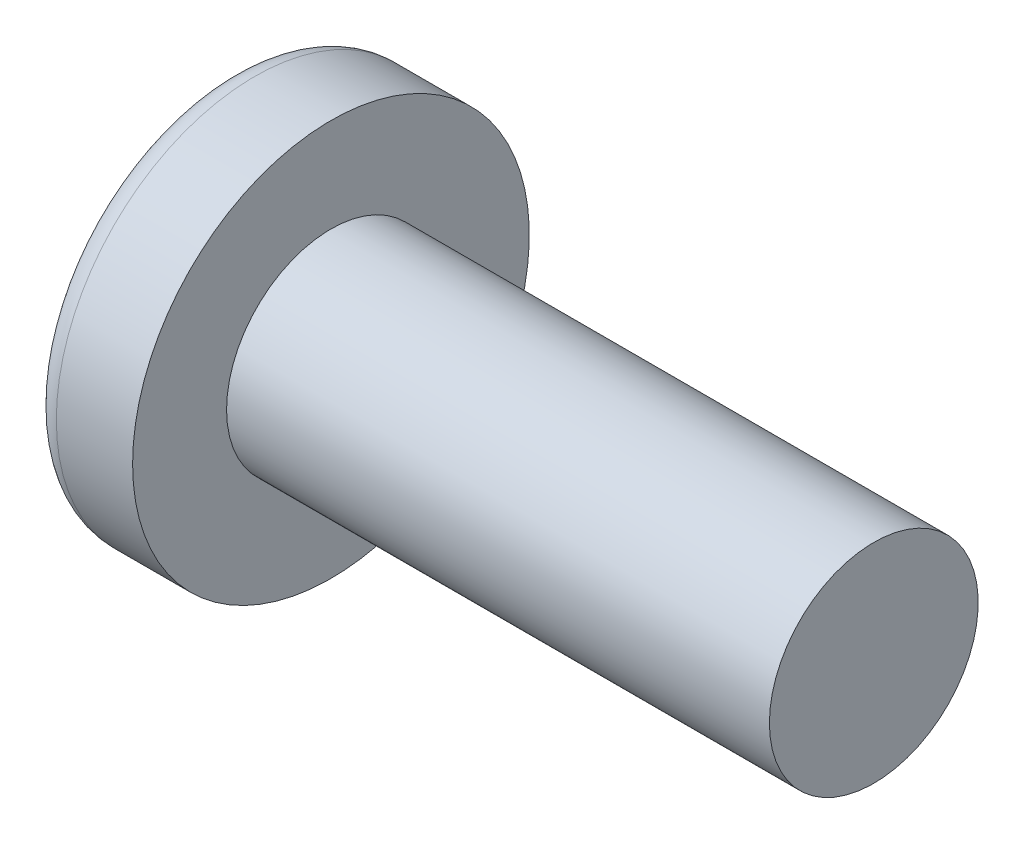
from build123d import *

# Parameters (mm, degrees)
CIRPATTERN1_COUNT = 2
CIRPATTERN1_ANGLE = 90


with BuildPart() as part:
    # BodySke → Base-Revolve (revolve)
    with BuildSketch(Plane.XY, mode=Mode.PRIVATE) as base_revolve_sk:
        with BuildLine():
            Line((3.7, 2.5), (3.7, 4.75))
            Line((3.7, 4.75), (1.873214546, 4.75))
            ThreePointArc((1.873214546, 4.75), (1.592049018, 4.680043343), (1.376448158, 4.486486486))
            ThreePointArc((1.376448158, 4.486486486), (0.351849415, 2.346442548), (0, 0))
            Line((0, 0), (16.7, 0))
            Line((16.7, 0), (16.7, 2.5))
            Line((16.7, 2.5), (3.7, 2.5))
        make_face()
    revolve(base_revolve_sk.sketch.rotate(Axis((-25.4, 0, 0), (1, 0, 0)), 90), axis=Axis((-25.4, 0, 0), (1, 0, 0)))

    # Sketch3 → Cut-Loft1 section 0
    with BuildSketch(Plane(origin=(0, 0, 0), x_dir=(0, 0, -1), z_dir=(1, 0, 0))):
        with BuildLine():
            Line((0.5, -2.45), (-0.5, -2.45))
            Line((-0.5, -2.45), (-0.5, 2.45))
            Line((-0.5, 2.45), (0.5, 2.45))
            Line((0.5, 2.45), (0.5, -2.45))
        make_face()
    # Sketch4 → Cut-Loft1 section 1
    with BuildSketch(Plane(origin=(2.95, 0, 0), x_dir=(0, 0, -1), z_dir=(1, 0, 0))):
        with BuildLine():
            Line((0.25, -0.25), (-0.25, -0.25))
            Line((-0.25, -0.25), (-0.25, 0.25))
            Line((-0.25, 0.25), (0.25, 0.25))
            Line((0.25, 0.25), (0.25, -0.25))
        make_face()
    cut_loft1 = loft(mode=Mode.SUBTRACT)

    # CirPattern1: Cut-Loft1 ×2 about axis
    cirpattern1_axis = Axis((0, 0, 0), (1, 0, 0))
    for i in range(1, CIRPATTERN1_COUNT):
        add(cut_loft1.rotate(cirpattern1_axis, i * CIRPATTERN1_ANGLE / (CIRPATTERN1_COUNT - 1)), mode=Mode.SUBTRACT)


solid = part.part
